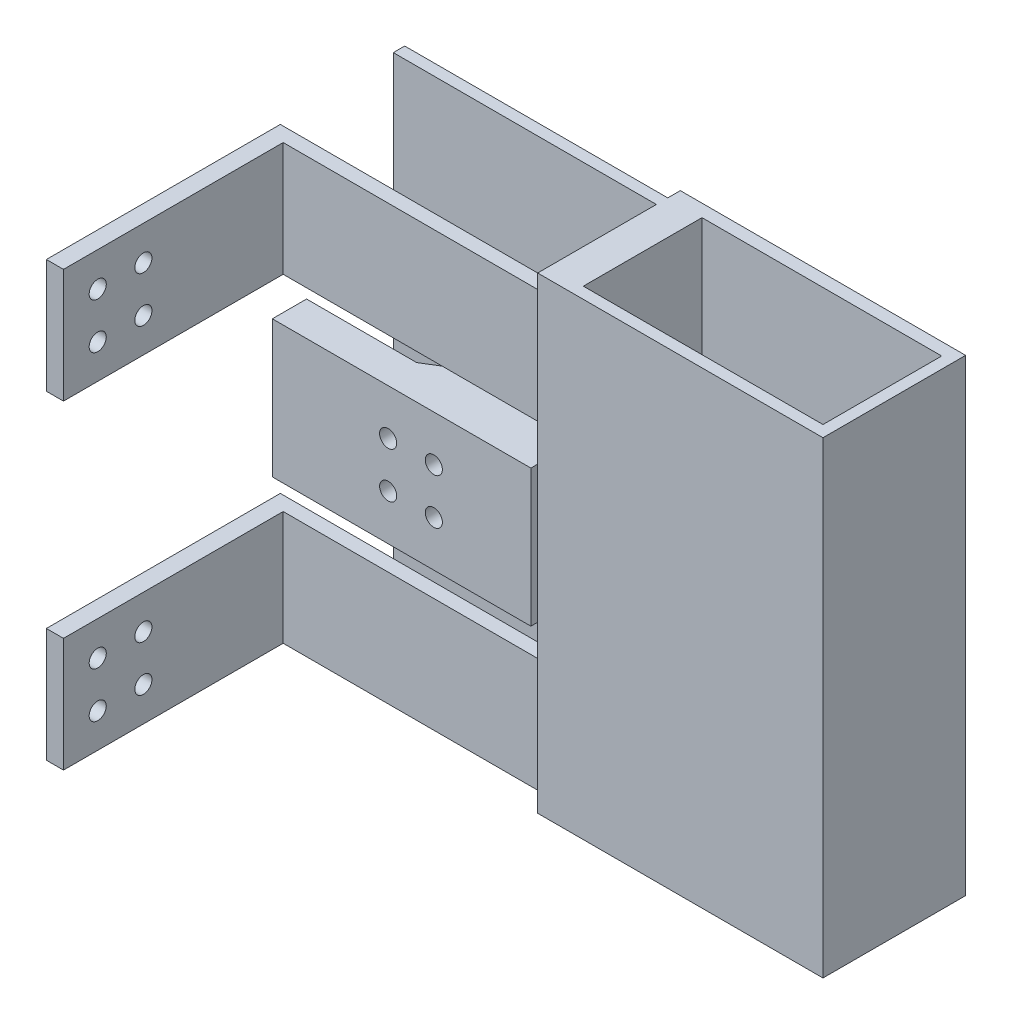
from build123d import *

# Parameters (mm, degrees)
SKETCH1_W            = 25
SKETCH1_H            = 82
BOSS_EXTRUDE1_DEPTH  = 6
SKETCH2_W            = 45.31
SKETCH2_H            = 24
BOSS_EXTRUDE2_DEPTH  = 6
BOSS_EXTRUDE3_DEPTH  = 3
BOSS_EXTRUDE4_DEPTH  = 3
SKETCH5_W            = 41
SKETCH5_H            = 20
BOSS_EXTRUDE5_DEPTH  = 3
SKETCH6_W            = 48.1
SKETCH6_H            = 20
BOSS_EXTRUDE6_DEPTH  = 2.5
SKETCH7_W            = 41
SKETCH7_H            = 20
BOSS_EXTRUDE7_DEPTH  = 3
SKETCH8_W            = 48.1
SKETCH8_H            = 20
BOSS_EXTRUDE8_DEPTH  = 2.5
SKETCH9_R            = 1.5
CUT_EXTRUDE1_DEPTH   = 3
SKETCH10_R           = 1.5
CUT_EXTRUDE2_DEPTH   = 3
SKETCH11_W           = 46.1
SKETCH11_H           = 82
BOSS_EXTRUDE9_DEPTH  = 2
SKETCH12_R           = 3
BOSS_EXTRUDE10_DEPTH = 5
SKETCH13_R           = 1.4
BOSS_EXTRUDE11_DEPTH = 2.5
SKETCH14_W           = 2
SKETCH14_H           = 82
BOSS_EXTRUDE12_DEPTH = 42
SKETCH15_W           = 2.2
SKETCH15_H           = 82
BOSS_EXTRUDE13_DEPTH = 42
SKETCH16_W           = 20.8
SKETCH16_H           = 2
BOSS_EXTRUDE14_DEPTH = 42
SKETCH17_W           = 25
SKETCH17_H           = 82
BOSS_EXTRUDE15_DEPTH = 2


with BuildPart() as part:
    # Sketch1 → Boss-Extrude1 (new body)
    with BuildSketch(Plane(origin=(-72.6, 0, 0), x_dir=(0, 0, -1), z_dir=(1, 0, 0))):
        with Locations((40.5, 0)):
            Rectangle(SKETCH1_W, SKETCH1_H)
    extrude(amount=BOSS_EXTRUDE1_DEPTH)

    # Sketch2 → Boss-Extrude2 (add)
    with BuildSketch(Plane.XY.offset(-32.8)):
        with Locations((-95.245, 0)):
            Rectangle(SKETCH2_W, SKETCH2_H)
    extrude(amount=BOSS_EXTRUDE2_DEPTH)

    # Sketch3 → Boss-Extrude3 (add)
    with BuildSketch(Plane(origin=(0, 9, 0), x_dir=(1, 0, 0), z_dir=(0, 1, 0))):
        Polygon((-72.6, 32.8), (-72.6, 48.8), (-98.6, 32.8), align=None)
    extrude(amount=BOSS_EXTRUDE3_DEPTH)

    # Sketch4 → Boss-Extrude4 (add)
    with BuildSketch(Plane(origin=(0, -12, 0), x_dir=(1, 0, 0), z_dir=(0, 1, 0))):
        Polygon((-72.6, 32.8), (-72.6, 48.8), (-98.6, 32.8), align=None)
    extrude(amount=BOSS_EXTRUDE4_DEPTH)



with BuildPart() as body_2:
    # Sketch5 → Boss-Extrude5 (new body)
    with BuildSketch(Plane(origin=(-120.7, 0, 0), x_dir=(0, 0, -1), z_dir=(1, 0, 0))):
        with Locations((10.5, 28)):
            Rectangle(SKETCH5_W, SKETCH5_H)
    extrude(amount=BOSS_EXTRUDE5_DEPTH)


with BuildPart() as part_1:
    add(part.part)

    add(body_2.part)  # Boss-Extrude6 merges body 2
    # Sketch6 → Boss-Extrude6 (add)
    with BuildSketch(Plane.XY.offset(-31)):
        with Locations((-96.65, 28)):
            Rectangle(SKETCH6_W, SKETCH6_H)
    extrude(amount=BOSS_EXTRUDE6_DEPTH)



with BuildPart() as body_2_2:
    # Sketch7 → Boss-Extrude7 (new body)
    with BuildSketch(Plane(origin=(-120.7, 0, 0), x_dir=(0, 0, -1), z_dir=(1, 0, 0))):
        with Locations((10.5, -28)):
            Rectangle(SKETCH7_W, SKETCH7_H)
    extrude(amount=BOSS_EXTRUDE7_DEPTH)


with BuildPart() as part_2:
    add(part_1.part)

    add(body_2_2.part)  # Boss-Extrude8 merges body 2 2
    # Sketch8 → Boss-Extrude8 (add)
    with BuildSketch(Plane.XY.offset(-31)):
        with Locations((-96.65, -28)):
            Rectangle(SKETCH8_W, SKETCH8_H)
    extrude(amount=BOSS_EXTRUDE8_DEPTH)

    # Sketch9 → Cut-Extrude1 (cut)
    with BuildSketch(Plane(origin=(-117.7, 0, 0), x_dir=(0, 0, -1), z_dir=(1, 0, 0))):
        with Locations((-4, 24)):
            Circle(SKETCH9_R)
        with Locations((4, 24)):
            Circle(SKETCH9_R)
        with Locations((-4, 32)):
            Circle(SKETCH9_R)
        with Locations((4, 32)):
            Circle(SKETCH9_R)
        with Locations((-4, -32)):
            Circle(SKETCH9_R)
        with Locations((4, -32)):
            Circle(SKETCH9_R)
        with Locations((-4, -24)):
            Circle(SKETCH9_R)
        with Locations((4, -24)):
            Circle(SKETCH9_R)
    extrude(amount=-CUT_EXTRUDE1_DEPTH, mode=Mode.SUBTRACT)

    # Sketch10 → Cut-Extrude2 (cut)
    with BuildSketch(Plane.XY.offset(-26.8)):
        with Locations((-89.6, 4)):
            Circle(SKETCH10_R)
        with Locations((-89.6, -4)):
            Circle(SKETCH10_R)
        with Locations((-97.6, 4)):
            Circle(SKETCH10_R)
        with Locations((-97.6, -4)):
            Circle(SKETCH10_R)
    extrude(amount=-CUT_EXTRUDE2_DEPTH, mode=Mode.SUBTRACT)

    # Sketch11 → Boss-Extrude9 (add)
    with BuildSketch(Plane.XY.offset(-50.8)):
        with Locations((-95.65, 0)):
            Rectangle(SKETCH11_W, SKETCH11_H)
    extrude(amount=BOSS_EXTRUDE9_DEPTH)

    # Sketch12 → Boss-Extrude10 (add)
    with BuildSketch(Plane.XY.offset(-55.8)):
        with Locations((-115.15, -29)):
            Circle(SKETCH12_R)
        with Locations((-115.15, 29)):
            Circle(SKETCH12_R)
        with Locations((-76.15, -29)):
            Circle(SKETCH12_R)
        with Locations((-76.15, 29)):
            Circle(SKETCH12_R)
    extrude(amount=BOSS_EXTRUDE10_DEPTH)

    # Sketch13 → Boss-Extrude11 (add)
    with BuildSketch(Plane.XY.offset(-58.3)):
        with Locations((-115.15, -29)):
            Circle(SKETCH13_R)
        with Locations((-115.15, 29)):
            Circle(SKETCH13_R)
        with Locations((-76.15, -29)):
            Circle(SKETCH13_R)
        with Locations((-76.15, 29)):
            Circle(SKETCH13_R)
    extrude(amount=BOSS_EXTRUDE11_DEPTH)

    # Sketch14 → Boss-Extrude12 (add)
    with BuildSketch(Plane(origin=(-66.6, 0, 0), x_dir=(0, 0, -1), z_dir=(1, 0, 0))):
        with Locations((29, 0)):
            Rectangle(SKETCH14_W, SKETCH14_H)
    extrude(amount=BOSS_EXTRUDE12_DEPTH)

    # Sketch15 → Boss-Extrude13 (add)
    with BuildSketch(Plane(origin=(-66.6, 0, 0), x_dir=(0, 0, -1), z_dir=(1, 0, 0))):
        with Locations((51.9, 0)):
            Rectangle(SKETCH15_W, SKETCH15_H)
    extrude(amount=BOSS_EXTRUDE13_DEPTH)

    # Sketch16 → Boss-Extrude14 (add)
    with BuildSketch(Plane(origin=(-66.6, 0, 0), x_dir=(0, 0, -1), z_dir=(1, 0, 0))):
        with Locations((40.4, -40)):
            Rectangle(SKETCH16_W, SKETCH16_H)
    extrude(amount=BOSS_EXTRUDE14_DEPTH)

    # Sketch17 → Boss-Extrude15 (add)
    with BuildSketch(Plane(origin=(-24.6, 0, 0), x_dir=(0, 0, -1), z_dir=(1, 0, 0))):
        with Locations((40.5, 0)):
            Rectangle(SKETCH17_W, SKETCH17_H)
    extrude(amount=BOSS_EXTRUDE15_DEPTH)


solid = part_2.part
